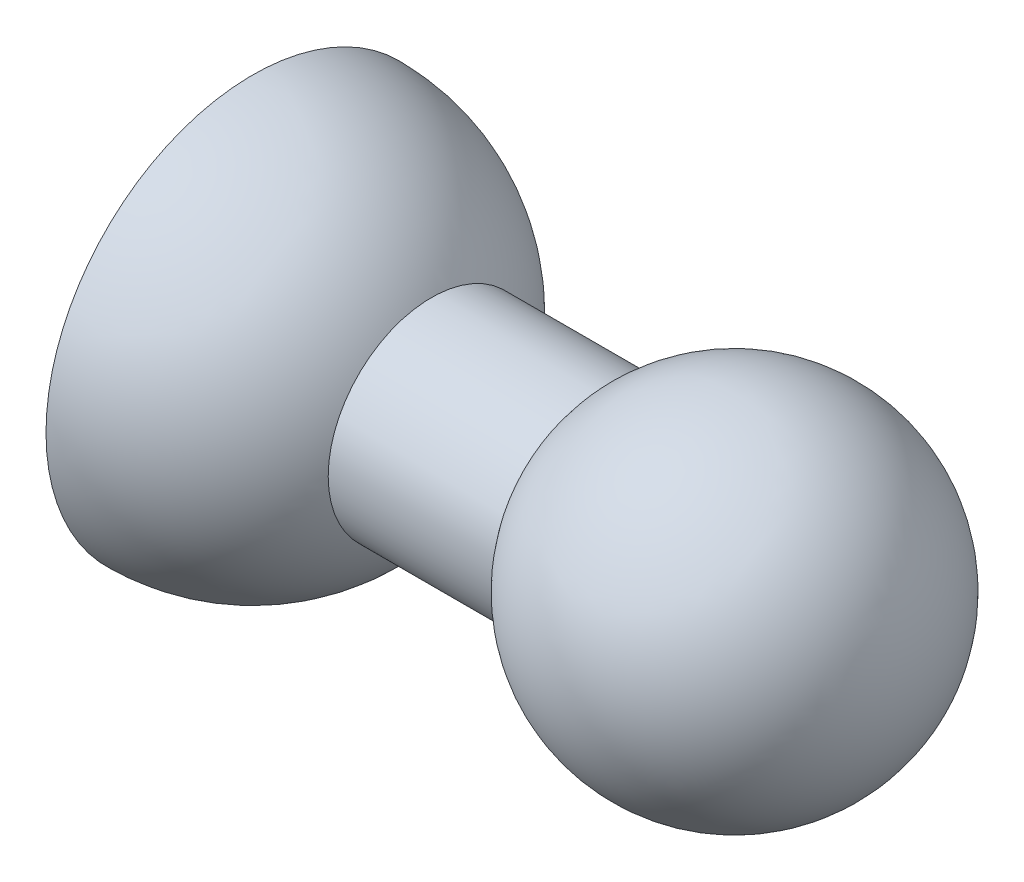
from build123d import *

# Parameters (mm, degrees)
SALIENTE_EXTRUIR2_START             = -40
CROQUIS2_R                          = 15
SALIENTE_EXTRUIR2_DEPTH             = 10
SALIENTE_EXTRUIR2_DIRECTION_2_REACH = 93.962


with BuildPart() as part:
    # Croquis1 → Revolución-Lámina1 (revolve)
    with BuildSketch(Plane(origin=(0, 0, 0), x_dir=(1, 0, 0), z_dir=(0, 1, 0))):
        with BuildLine():
            ThreePointArc((25, 0), (17.67766953, 17.67766953), (0, 25))
            Line((0, 25), (0, 30))
            ThreePointArc((0, 30), (21.213203436, 21.213203436), (30, 0))
            Line((30, 0), (25, 0))
        make_face()
    revolve(axis=Axis((0, 0, 0), (1, 0, 0)))

    # Croquis2 → Saliente-Extruir2 (add)
    with BuildSketch(Plane.ZY.offset(SALIENTE_EXTRUIR2_START)):
        Circle(CROQUIS2_R)
    extrude(amount=-SALIENTE_EXTRUIR2_DEPTH)

    # Croquis2 → Saliente-Extruir2 direction 2 (add, up to next)
    with BuildSketch(Plane.ZY.offset(SALIENTE_EXTRUIR2_START), mode=Mode.PRIVATE) as saliente_extruir2_direction_2_sk1:
        Circle(CROQUIS2_R)
    saliente_extruir2_direction_2_tool1 = extrude(saliente_extruir2_direction_2_sk1.sketch, amount=SALIENTE_EXTRUIR2_DIRECTION_2_REACH, mode=Mode.PRIVATE) - part.part
    add(saliente_extruir2_direction_2_tool1.solids().sort_by_distance((40, 0, 0))[0])

    # Croquis3 → Revolución1 (revolve)
    with BuildSketch(Plane.XY, mode=Mode.PRIVATE) as revoluci_n1_sk:
        with BuildLine():
            Line((50, 0), (50, 15))
            ThreePointArc((50, 15), (77.90569415, 23.717082451), (95, 0))
            Line((95, 0), (50, 0))
        make_face()
    revolve(revoluci_n1_sk.sketch.rotate(Axis((50, 0, 0), (1, 0, 0)), 90), axis=Axis((50, 0, 0), (1, 0, 0)))


solid = part.part
